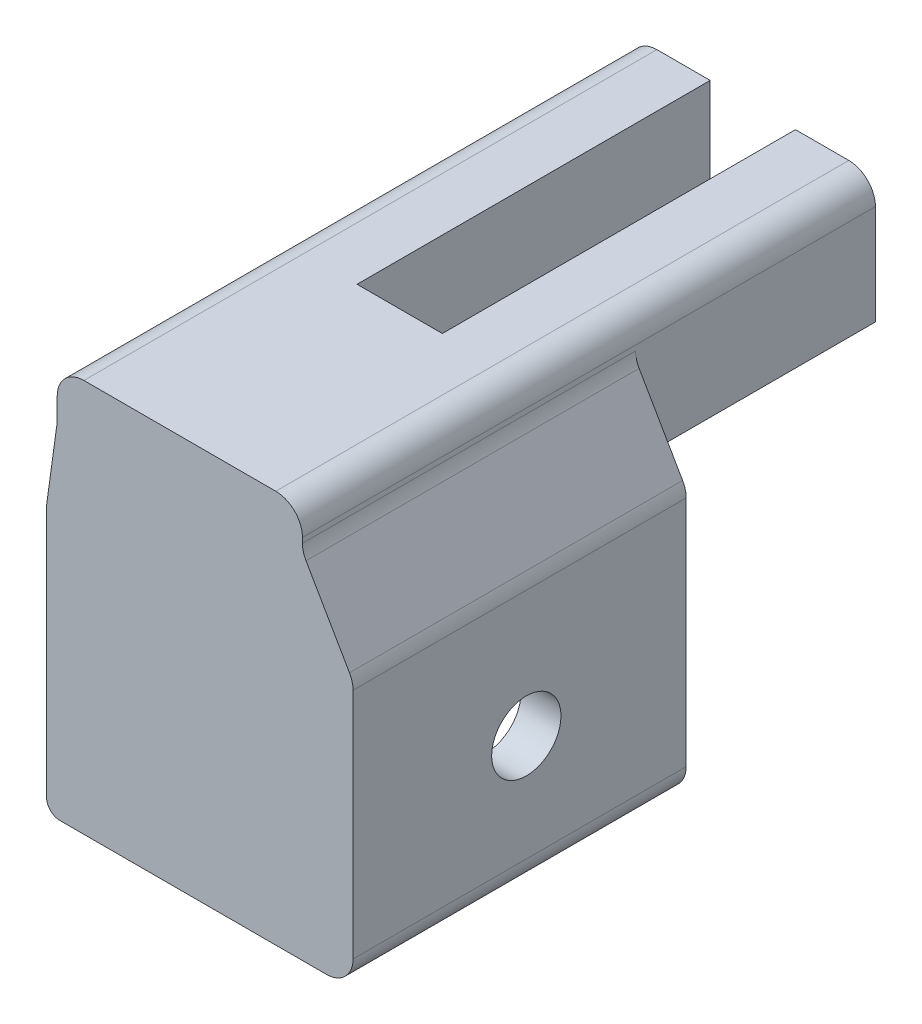
from build123d import *

# Parameters (mm, degrees)
SKETCH_1_W          = 20
SKETCH_1_H          = 20
EXTRUDE_1_DEPTH     = 3
SKETCH_2_W          = 7
SKETCH_2_H          = 6
EXTRUDE_2_DEPTH     = 40
SKETCH_3_W          = 3
SKETCH_3_H          = 20
EXTRUDE_3_DEPTH     = 25
CUT_EXTRUDE_1_REACH = 49.212
SKETCH_4_R          = 2.6
FILLET_1_R          = 1
SKETCH_5_W          = 3.2
SKETCH_5_H          = 3.9
CUT_EXTRUDE_2_DEPTH = 30
SKETCH_6_W          = 6
SKETCH_6_H          = 9.5
EXTRUDE_4_DEPTH     = 43
CHAMFER_1_SIZE      = 0.5
SKETCH_7_W          = 6.4
SKETCH_7_H          = 9.5
EXTRUDE_5_DEPTH     = 16.5
EXTRUDE_6_DEPTH     = 25
FILLET_2_R          = 2
EXTRUDE_7_DEPTH     = 43
SKETCH_10_W         = 1.9
SKETCH_10_H         = 2
CUT_EXTRUDE_3_DEPTH = 26.5
FILLET_3_R          = 0.5
FILLET_4_R          = 1.5


with BuildPart() as part:
    # ｽｹｯﾁ1 → ﾎﾞｽ - 押し出し1 (new body)
    with BuildSketch(Plane.XY):
        Rectangle(SKETCH_1_W, SKETCH_1_H)
    extrude(amount=EXTRUDE_1_DEPTH)

    # ｽｹｯﾁ2 → ﾎﾞｽ - 押し出し2 (add)
    with BuildSketch(Plane(origin=(0, 0, 0), x_dir=(-1, 0, 0), z_dir=(0, 0, -1))):
        with Locations((0, 7)):
            Rectangle(SKETCH_2_W, SKETCH_2_H)
    extrude(amount=EXTRUDE_2_DEPTH)

    # ｽｹｯﾁ3 → ﾎﾞｽ - 押し出し3 (add)
    with BuildSketch(Plane.XY.offset(3)):
        with Locations((11.5, 0)):
            Rectangle(SKETCH_3_W, SKETCH_3_H)
    extrude(amount=-EXTRUDE_3_DEPTH)

    # ｽｹｯﾁ4 → ｶｯﾄ - 押し出し1 (cut, up to next)
    with BuildSketch(Plane(origin=(13, 0, 0), x_dir=(0, 0, -1), z_dir=(1, 0, 0)), mode=Mode.PRIVATE) as cut_extrude_1_sk1:
        with Locations(Location((10, 0, 0), (0, 0, 90))):
            Circle(SKETCH_4_R)
    cut_extrude_1_tool1 = extrude(cut_extrude_1_sk1.sketch, amount=-CUT_EXTRUDE_1_REACH, mode=Mode.PRIVATE) & part.part
    add(cut_extrude_1_tool1.solids().sort_by_distance((13, 0, -10))[0], mode=Mode.SUBTRACT)

    # ﾌｨﾚｯﾄ1
    fillet_1_edges = [part.edges().sort_by_distance(p)[0] for p in [
        (-10, -10, 1.5),
    ]]
    fillet(fillet_1_edges, radius=FILLET_1_R)

    # ｽｹｯﾁ5 → ｶｯﾄ - 押し出し2 (cut)
    with BuildSketch(Plane(origin=(0, 0, -13.5), x_dir=(-1, 0, 0), z_dir=(0, 0, -1))):
        with Locations((0, 8.05)):
            Rectangle(SKETCH_5_W, SKETCH_5_H)
    extrude(amount=CUT_EXTRUDE_2_DEPTH, mode=Mode.SUBTRACT)

    # ｽｹｯﾁ6 → ﾎﾞｽ - 押し出し4 (add)
    with BuildSketch(Plane.XY.offset(3)):
        with Locations((6.2, 14.75)):
            Rectangle(SKETCH_6_W, SKETCH_6_H)
        with Locations((-6.2, 14.75)):
            Rectangle(SKETCH_6_W, SKETCH_6_H)
    extrude(amount=-EXTRUDE_4_DEPTH)

    # 面取り1
    chamfer_1_edges = [part.edges().sort_by_distance(p)[0] for p in [
        (-3.5, 10, -20),
        (3.5, 10, -20),
    ]]
    chamfer(chamfer_1_edges, length=CHAMFER_1_SIZE)

    # ｽｹｯﾁ7 → ﾎﾞｽ - 押し出し5 (add)
    with BuildSketch(Plane.XY.offset(3)):
        with Locations((0, 14.75)):
            Rectangle(SKETCH_7_W, SKETCH_7_H)
    extrude(amount=-EXTRUDE_5_DEPTH)

    # ｽｹｯﾁ8 → ﾎﾞｽ - 押し出し6 (add)
    with BuildSketch(Plane.XY.offset(3)):
        Polygon((13, 10), (9.2, 16.581793069), (9.2, 10), align=None)
    extrude(amount=-EXTRUDE_6_DEPTH)

    # ﾌｨﾚｯﾄ2
    fillet_2_edges = [part.edges().sort_by_distance(p)[0] for p in [
        (9.2, 16.581793069, -9.5),
        (13, 10, -9.5),
        (13, -10, -9.5),
        (9.2, 19.5, -18.5),
        (-9.2, 19.5, -18.5),
    ]]
    fillet(fillet_2_edges, radius=FILLET_2_R)

    # ｽｹｯﾁ9 → ﾎﾞｽ - 押し出し7 (add)
    with BuildSketch(Plane.XY.offset(3)):
        Polygon((-10, 10), (-9.2, 15.8), (-9.2, 10), align=None)
    extrude(amount=-EXTRUDE_7_DEPTH)

    # ｽｹｯﾁ10 → ｶｯﾄ - 押し出し3 (cut)
    with BuildSketch(Plane(origin=(0, 0, -40), x_dir=(-1, 0, 0), z_dir=(0, 0, -1))):
        with Locations((2.55, 7.1)):
            Rectangle(SKETCH_10_W, SKETCH_10_H)
    extrude(amount=-CUT_EXTRUDE_3_DEPTH, mode=Mode.SUBTRACT)

    # ﾌｨﾚｯﾄ3
    fillet_3_edges = [part.edges().sort_by_distance(p)[0] for p in [
        (-3.5, 6.1, -26.75),
        (-3.5, 8.1, -26.75),
    ]]
    fillet(fillet_3_edges, radius=FILLET_3_R)

    # ﾌｨﾚｯﾄ4
    fillet_4_edges = [part.edges().sort_by_distance(p)[0] for p in [
        (-3.5, 4, -20),
        (3.5, 4, -20),
    ]]
    fillet(fillet_4_edges, radius=FILLET_4_R)


solid = part.part
